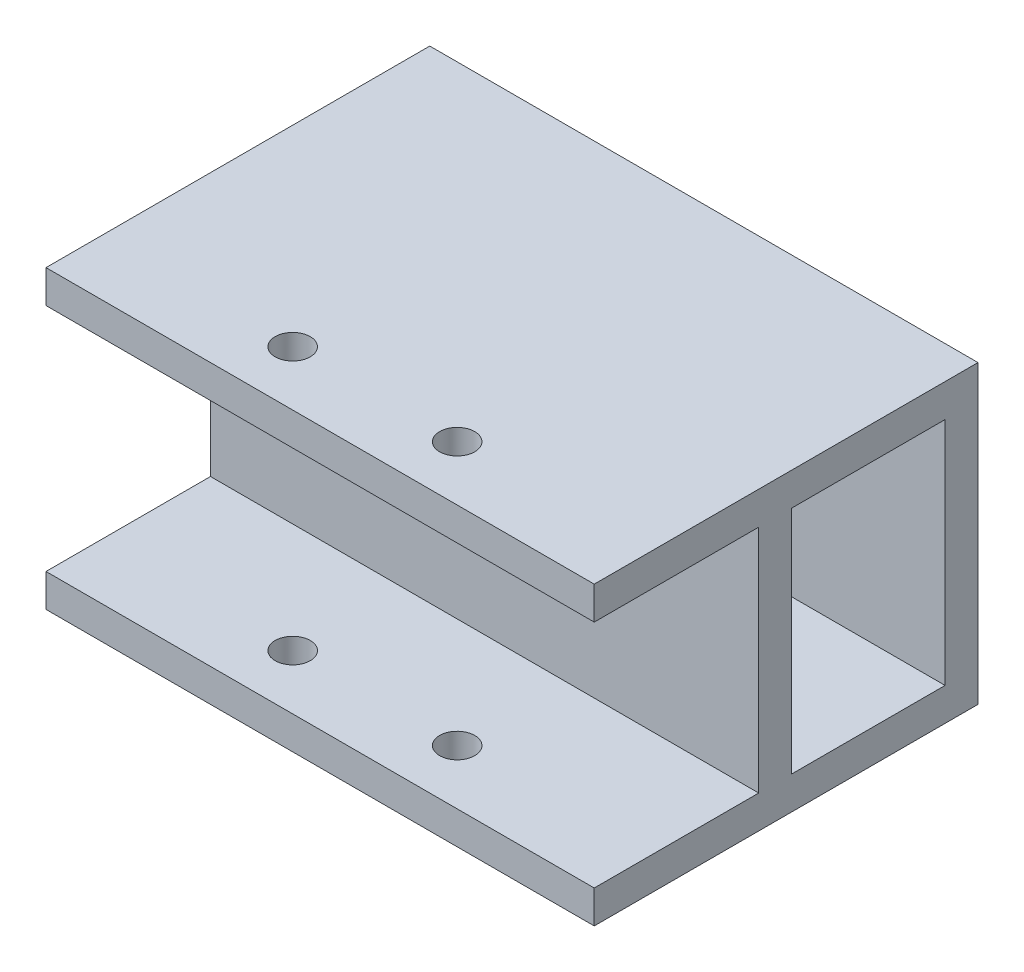
from build123d import *

# Parameters (mm, degrees)
SKETCH_1_W          = 50
SKETCH_1_H          = 27
EXTRUDE_1_DEPTH     = 35
SKETCH_2_W          = 50
SKETCH_2_H          = 21
CUT_EXTRUDE_1_DEPTH = 15
SKETCH_3_R          = 1.6
CUT_EXTRUDE_2_DEPTH = 53.758784453
SKETCH_4_W          = 14
SKETCH_4_H          = 21
CUT_EXTRUDE_3_DEPTH = 63.544986529


with BuildPart() as part:
    # 草图1 → 凸台-拉伸1 (new body)
    with BuildSketch(Plane.XY):
        with Locations((3.800856531, -0.170235546)):
            Rectangle(SKETCH_1_W, SKETCH_1_H)
    extrude(amount=EXTRUDE_1_DEPTH)

    # 草图2 → 切除-拉伸1 (cut)
    with BuildSketch(Plane.XY.offset(35)):
        with Locations((3.800856531, -0.170235546)):
            Rectangle(SKETCH_2_W, SKETCH_2_H)
    extrude(amount=-CUT_EXTRUDE_1_DEPTH, mode=Mode.SUBTRACT)

    # 草图3 → 切除-拉伸2 (cut, through all)
    with BuildSketch(Plane.XZ.offset(13.670235546)):
        with Locations(Location((-3.699143469, 30, 0), (0, 0, 270))):
            Circle(SKETCH_3_R)
        with Locations(Location((11.300856531, 30, 0), (0, 0, 270))):
            Circle(SKETCH_3_R)
    extrude(amount=-CUT_EXTRUDE_2_DEPTH, mode=Mode.SUBTRACT)

    # 草图4 → 切除-拉伸3 (cut, through all)
    with BuildSketch(Plane.ZY.offset(21.199143469)):
        with Locations((10, -0.170235546)):
            Rectangle(SKETCH_4_W, SKETCH_4_H)
    extrude(amount=-CUT_EXTRUDE_3_DEPTH, mode=Mode.SUBTRACT)


solid = part.part
